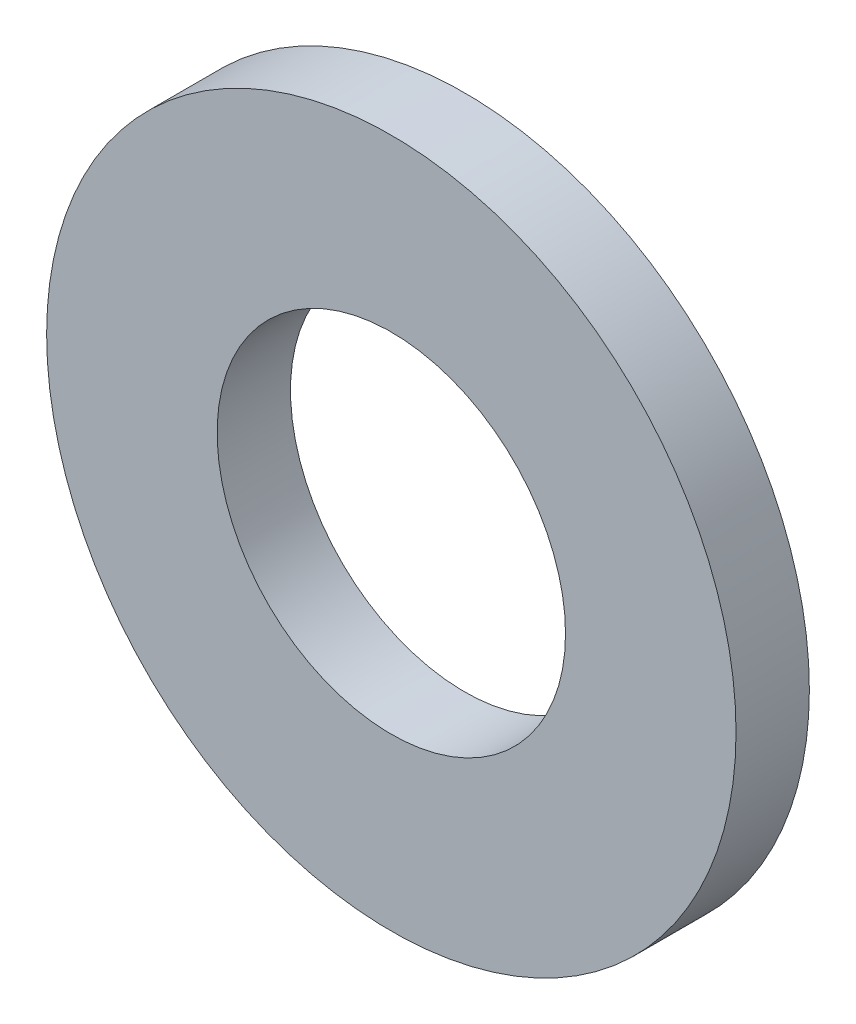
from build123d import *

# Parameters (mm, degrees)
SKETCH1_R           = 9.4
SKETCH1_R_2         = 4.75
BOSS_EXTRUDE1_DEPTH = 2


with BuildPart() as part:
    # Sketch1 → Boss-Extrude1 (new body)
    with BuildSketch(Plane.XY):
        Circle(SKETCH1_R)
        Circle(SKETCH1_R_2, mode=Mode.SUBTRACT)
    extrude(amount=-BOSS_EXTRUDE1_DEPTH)


solid = part.part
